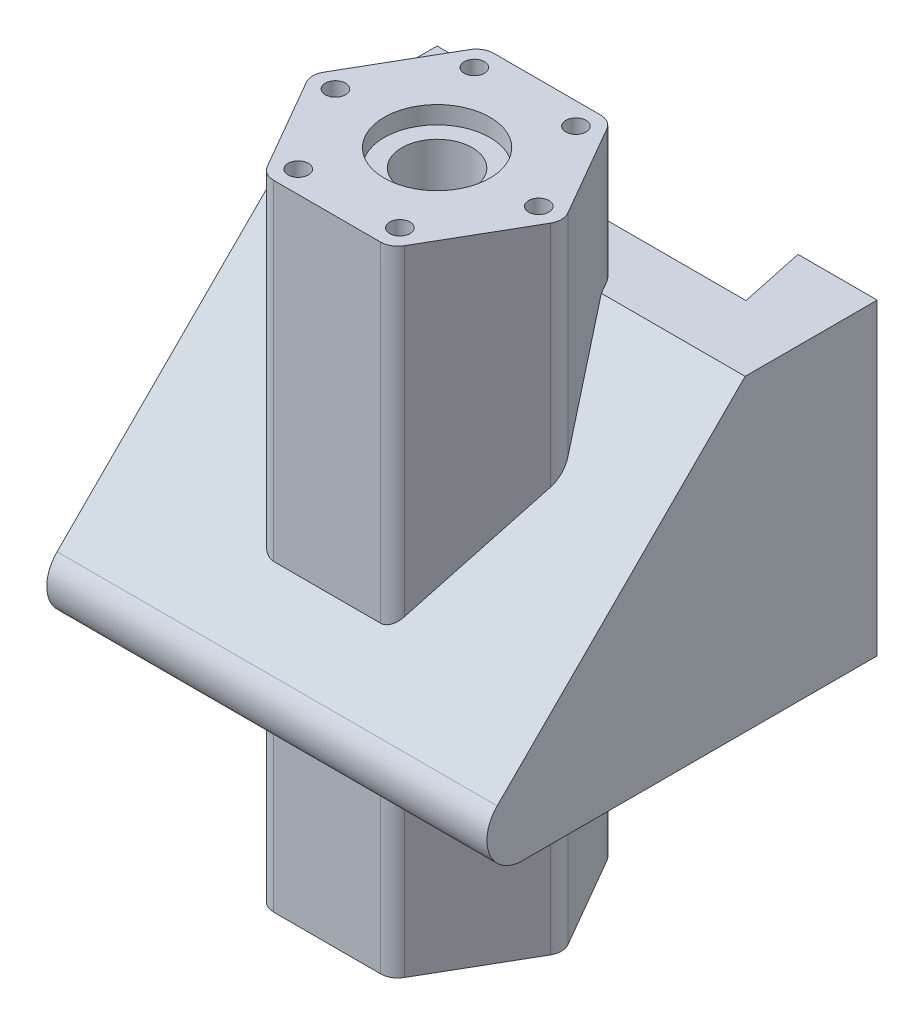
from build123d import *

# Parameters (mm, degrees)
BOSS_EXTRUDE1_DEPTH            = 25
BOSS_EXTRUDE2_DEPTH            = 50
BOSS_EXTRUDE2_DEPTH_BACK       = 22
CUT_EXTRUDE1_DEPTH             = 89.177744216
CUT_EXTRUDE1_DEPTH_BACK        = 89.177744216
SKETCH3_R                      = 4
SKETCH4_R                      = 6
CUT_EXTRUDE2_DEPTH             = 2
CUT_EXTRUDE3_DEPTH             = 77.421950872
CUT_EXTRUDE3_DEPTH_BACK        = 77.421950872
F_2_3_2_3_DIAMETER_HOLE1_D     = 2.3
F_2_3_2_3_DIAMETER_HOLE1_DEPTH = 4
F_2_3_2_3_DIAMETER_HOLE1_TIP   = 0.690989712


with BuildPart() as part:
    # Sketch1 → Boss-Extrude1 (new, symmetric)
    with BuildSketch(Plane(origin=(0, 0, 0), x_dir=(0, 0, -1), z_dir=(1, 0, 0))):
        with BuildLine():
            Line((0, 0), (-40.343145751, 0))
            ThreePointArc((-40.343145751, 0), (-44.038663881, 2.469266271), (-43.171572875, 6.828427125))
            Line((-43.171572875, 6.828427125), (-15, 35))
            Line((-15, 35), (0, 35))
            Line((0, 35), (0, 0))
        make_face()
    extrude(amount=BOSS_EXTRUDE1_DEPTH, both=True)

    # Sketch2 → Boss-Extrude2 (add, two sides: drawn at the far end of the back side and taken through both)
    with BuildSketch(Plane(origin=(0, 0, 0), x_dir=(1, 0, 0), z_dir=(0, 1, 0)).offset(-BOSS_EXTRUDE2_DEPTH_BACK)):
        with BuildLine():
            Line((-7.794228634, -13.5), (-13.856406461, -24))
            ThreePointArc((-13.856406461, -24), (-14.124355653, -25), (-13.856406461, -26))
            Line((-13.856406461, -26), (-7.794228634, -36.5))
            ThreePointArc((-7.794228634, -36.5), (-7.062177826, -37.232050808), (-6.062177826, -37.5))
            Line((-6.062177826, -37.5), (6.062177826, -37.5))
            ThreePointArc((6.062177826, -37.5), (7.062177826, -37.232050808), (7.794228634, -36.5))
            Line((7.794228634, -36.5), (13.856406461, -26))
            ThreePointArc((13.856406461, -26), (14.124355653, -25), (13.856406461, -24))
            Line((13.856406461, -24), (7.794228634, -13.5))
            ThreePointArc((7.794228634, -13.5), (7.062177826, -12.767949192), (6.062177826, -12.5))
            Line((6.062177826, -12.5), (-6.062177826, -12.5))
            ThreePointArc((-6.062177826, -12.5), (-7.062177826, -12.767949192), (-7.794228634, -13.5))
        make_face()
    extrude(amount=BOSS_EXTRUDE2_DEPTH + BOSS_EXTRUDE2_DEPTH_BACK)

    # Sketch3 → Cut-Extrude1 (cut, two sides: drawn at the far end of the back side and taken through both)
    with BuildSketch(Plane(origin=(0, 50, 0), x_dir=(1, 0, 0), z_dir=(0, 1, 0)).offset(-CUT_EXTRUDE1_DEPTH_BACK)):
        with Locations(Location((0, -25, 0), (0, 0, 270))):
            Circle(SKETCH3_R)
    extrude(amount=CUT_EXTRUDE1_DEPTH + CUT_EXTRUDE1_DEPTH_BACK, mode=Mode.SUBTRACT)

    # Sketch4 → Cut-Extrude2 (cut)
    with BuildSketch(Plane(origin=(0, 50, 0), x_dir=(1, 0, 0), z_dir=(0, 1, 0))):
        with Locations(Location((0, -25, 0), (0, 0, 270))):
            Circle(SKETCH4_R)
    extrude(amount=-CUT_EXTRUDE2_DEPTH, mode=Mode.SUBTRACT)

    # Sketch5 → Cut-Extrude3 (cut, two sides: drawn at the far end of the back side and taken through both)
    with BuildSketch(Plane(origin=(0, 35, 0), x_dir=(1, 0, 0), z_dir=(0, 1, 0)).offset(-CUT_EXTRUDE3_DEPTH_BACK)):
        Polygon((-17.594174213, -7.5), (17.594174213, -7.5), (16, 0), (-16, 0), align=None)
    extrude(amount=CUT_EXTRUDE3_DEPTH + CUT_EXTRUDE3_DEPTH_BACK, mode=Mode.SUBTRACT)

    # Ø2.3 (2.3) Diameter Hole1
    with Locations(Plane(origin=(0, 50, 0), x_dir=(1, 0, 0), z_dir=(0, 1, 0))):
        with Locations((-11.547005384, -25), (-5.773502692, -15), (5.773502692, -15), (11.547005384, -25), (5.773502692, -35), (-5.773502692, -35)):
            Hole(F_2_3_2_3_DIAMETER_HOLE1_D / 2, depth=F_2_3_2_3_DIAMETER_HOLE1_DEPTH)
            with Locations((0, 0, -(F_2_3_2_3_DIAMETER_HOLE1_DEPTH + F_2_3_2_3_DIAMETER_HOLE1_TIP / 2))):  # 118° drill point
                Cone(0, F_2_3_2_3_DIAMETER_HOLE1_D / 2, F_2_3_2_3_DIAMETER_HOLE1_TIP, mode=Mode.SUBTRACT)


solid = part.part
